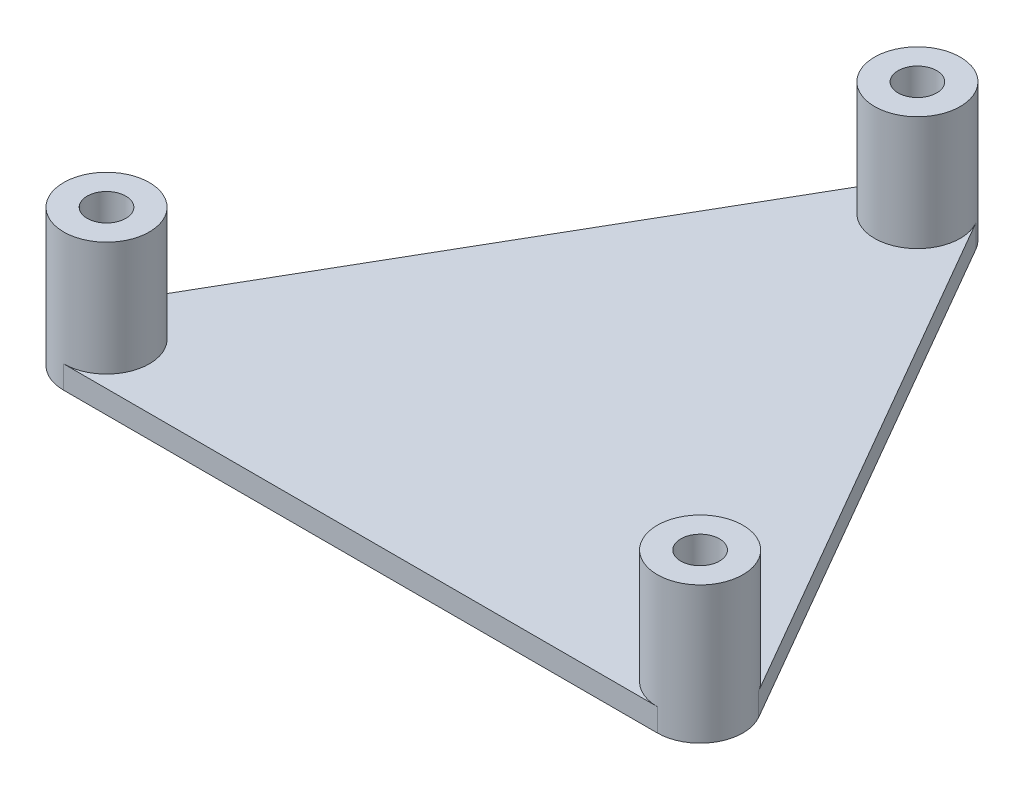
from build123d import *

# Parameters (mm, degrees)
SKETCH1_R           = 42.8625
SKETCH1_R_2         = 2.15
BOSS_EXTRUDE1_DEPTH = 2.54
CUT_EXTRUDE1_START  = -2.54
CUT_EXTRUDE1_DEPTH  = 2.54
SKETCH6_R           = 4.7625
SKETCH6_R_2         = 2.15
BOSS_EXTRUDE4_DEPTH = 12.7


with BuildPart() as part:
    # Sketch1 → Boss-Extrude1 (new body)
    with BuildSketch(Plane(origin=(0, 0, 0), x_dir=(1, 0, 0), z_dir=(0, 1, 0))):
        Circle(SKETCH1_R)
        with Locations((0, 38.1)):
            Circle(SKETCH1_R_2, mode=Mode.SUBTRACT)
        with Locations((32.995567884, -19.05)):
            Circle(SKETCH1_R_2, mode=Mode.SUBTRACT)
        with Locations((-32.995567884, -19.05)):
            Circle(SKETCH1_R_2, mode=Mode.SUBTRACT)
    extrude(amount=BOSS_EXTRUDE1_DEPTH)

    # Sketch2 → Cut-Extrude1 (cut)
    with BuildSketch(Plane(origin=(0, 2.54, 0), x_dir=(1, 0, 0), z_dir=(0, 1, 0)).offset(CUT_EXTRUDE1_START)):
        with BuildLine():
            Line((-37.12001387, -16.66875), (-4.124445986, 40.48125))
            ThreePointArc((-4.124445986, 40.48125), (-2.381249978, 42.224445998), (5.1e-08, 42.8625))
            ThreePointArc((5.1e-08, 42.8625), (-37.120013889, 21.431249967), (-37.120013806, -21.431250111))
            ThreePointArc((-37.120013806, -21.431250111), (-37.758067884, -19.050000064), (-37.12001387, -16.66875))
        make_face()
        with BuildLine():
            ThreePointArc((37.120013869, -21.431250002), (37.120013883, 21.431249977), (5.1e-08, 42.8625))
            ThreePointArc((5.1e-08, 42.8625), (2.381250022, 42.224445973), (4.124445986, 40.48125))
            Line((4.124445986, 40.48125), (37.12001387, -16.66875))
            ThreePointArc((37.12001387, -16.66875), (37.758067884, -19.050000001), (37.120013869, -21.431250002))
        make_face()
        with BuildLine():
            ThreePointArc((-32.995567884, -23.8125), (-35.376817829, -23.174446018), (-37.120013806, -21.431250111))
            ThreePointArc((-37.120013806, -21.431250111), (6.3e-08, -42.8625), (37.120013869, -21.431250002))
            ThreePointArc((37.120013869, -21.431250002), (35.376817883, -23.174445986), (32.995567884, -23.8125))
            Line((32.995567884, -23.8125), (-32.995567884, -23.8125))
        make_face()
    extrude(amount=CUT_EXTRUDE1_DEPTH, mode=Mode.SUBTRACT)

    # Sketch6 → Boss-Extrude4 (add)
    # profile 1 of 3: a face of its own
    with BuildSketch(Plane(origin=(0, 2.54, 0), x_dir=(1, 0, 0), z_dir=(0, 1, 0))):
        with Locations((0, 38.1)):
            Circle(SKETCH6_R)
        with Locations((0, 38.1)):
            Circle(SKETCH6_R_2, mode=Mode.SUBTRACT)
    # profile 2 of 3: a face of its own
    with BuildSketch(Plane(origin=(0, 2.54, 0), x_dir=(1, 0, 0), z_dir=(0, 1, 0))):
        with Locations((32.995567884, -19.05)):
            Circle(SKETCH6_R)
        with Locations((32.995567884, -19.05)):
            Circle(SKETCH6_R_2, mode=Mode.SUBTRACT)
    # profile 3 of 3: a face of its own
    with BuildSketch(Plane(origin=(0, 2.54, 0), x_dir=(1, 0, 0), z_dir=(0, 1, 0))):
        with Locations((-32.995567884, -19.05)):
            Circle(SKETCH6_R)
        with Locations((-32.995567884, -19.05)):
            Circle(SKETCH6_R_2, mode=Mode.SUBTRACT)
    extrude(amount=BOSS_EXTRUDE4_DEPTH)


solid = part.part
